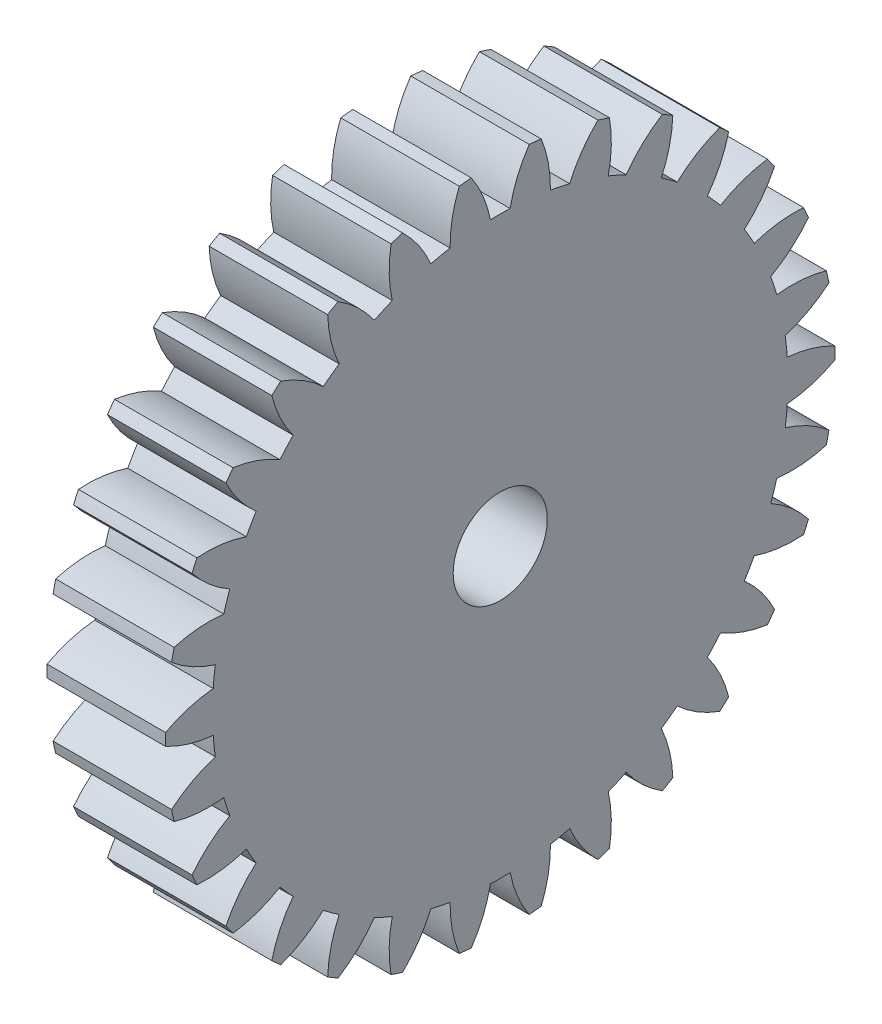
from build123d import *

# Parameters (mm, degrees)
BASPROSKE_W     = 5.9944
BASPROSKE_H     = 16.933333333
TOOTHCUT_DEPTH  = 25.686198308
TEETHCUTS_COUNT = 30
TEETHCUTS_ANGLE = 348
BORSKE_R        = 2.38125
BORE_DEPTH      = 50.8000508


with BuildPart() as part:
    # BasProSke → Base-Revolve (revolve)
    with BuildSketch(Plane(origin=(0, 0, 0), x_dir=(1, 0, 0), z_dir=(0, 1, 0)), mode=Mode.PRIVATE) as base_revolve_sk:
        with Locations((2.9972, 8.466666667)):
            Rectangle(BASPROSKE_W, BASPROSKE_H)
    revolve(base_revolve_sk.sketch.rotate(Axis((-10, 0, 0), (1, 0, 0)), 180), axis=Axis((-10, 0, 0), (1, 0, 0)))

    # TooCutSke → ToothCut (cut, through all)
    with BuildSketch(Plane(origin=(0, 0, 0), x_dir=(0, 0, -1), z_dir=(1, 0, 0))):
        with BuildLine():
            ThreePointArc((0.498170969, 14.545671635), (0, 14.5542), (-0.498170969, 14.545671635))
            ThreePointArc((-0.498170969, 14.545671635), (-0.871491697, 15.769583116), (-1.482606883, 16.893801026))
            ThreePointArc((-1.482606883, 16.893801026), (0, 16.958733333), (1.482606883, 16.893801026))
            ThreePointArc((1.482606883, 16.893801026), (0.871491697, 15.769583116), (0.498170969, 14.545671635))
        make_face()
    toothcut = extrude(amount=TOOTHCUT_DEPTH, mode=Mode.SUBTRACT)

    # TeethCuts: ToothCut ×30 about axis
    teethcuts_axis = Axis((-10, 0, 0), (1, 0, 0))
    for i in range(1, TEETHCUTS_COUNT):
        add(toothcut.rotate(teethcuts_axis, i * TEETHCUTS_ANGLE / (TEETHCUTS_COUNT - 1)), mode=Mode.SUBTRACT)

    # BorSke → Bore (cut, symmetric)
    with BuildSketch(Plane(origin=(0, 0, 0), x_dir=(0, 0, -1), z_dir=(1, 0, 0))):
        with Locations(Location((0, 0, 0), (0, 0, 180))):
            Circle(BORSKE_R)
    extrude(amount=BORE_DEPTH, both=True, mode=Mode.SUBTRACT)


solid = part.part
